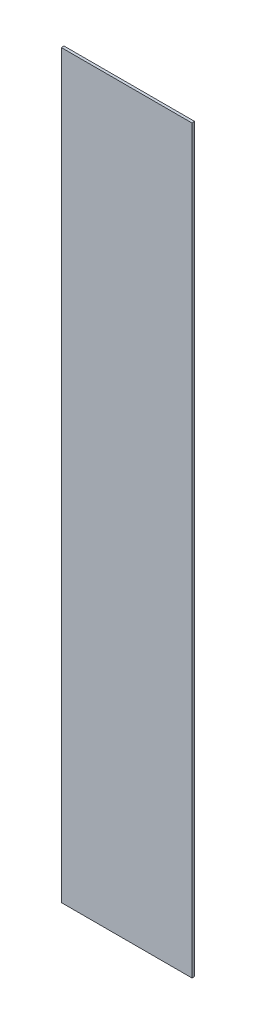
from build123d import *

# Parameters (mm, degrees)
SKETCH1_W           = 97
SKETCH1_H           = 550
BOSS_EXTRUDE1_DEPTH = 1


with BuildPart() as part:
    # Sketch1 → Boss-Extrude1 (new, symmetric)
    with BuildSketch(Plane.XY):
        Rectangle(SKETCH1_W, SKETCH1_H)
    extrude(amount=BOSS_EXTRUDE1_DEPTH, both=True)


solid = part.part
